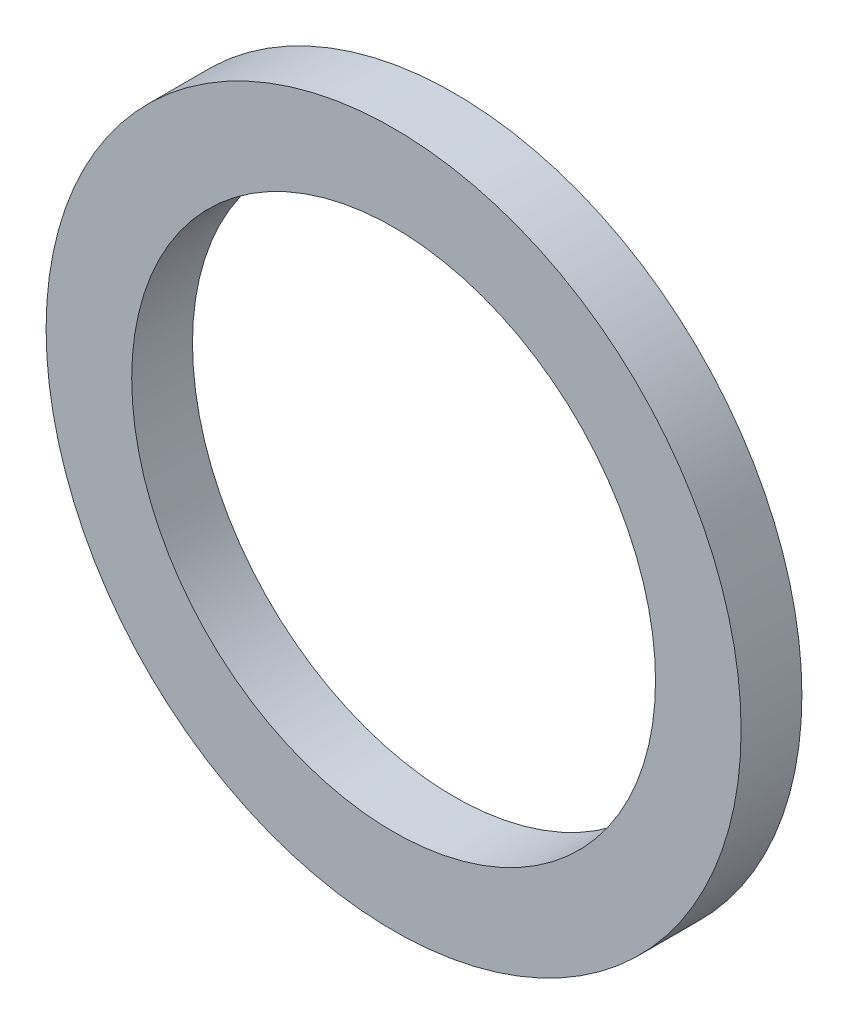
from build123d import *

# Parameters (mm, degrees)
IZIM1_R                     = 14.29
IZIM1_R_2                   = 11.6
IZIM1_R_3                   = 10.77
Y_KSEKLIK_EKSTR_ZYON4_DEPTH = 2.5


with BuildPart() as part:
    # Çizim1 → Yükseklik-Ekstrüzyon4 (new body)
    # profile 1 of 2: a face of its own
    with BuildSketch(Plane.XY):
        Circle(IZIM1_R)
        Circle(IZIM1_R_2, mode=Mode.SUBTRACT)
    # profile 2 of 2: a face of its own
    with BuildSketch(Plane.XY):
        Circle(IZIM1_R_2)
        Circle(IZIM1_R_3, mode=Mode.SUBTRACT)
    extrude(amount=Y_KSEKLIK_EKSTR_ZYON4_DEPTH)


solid = part.part
